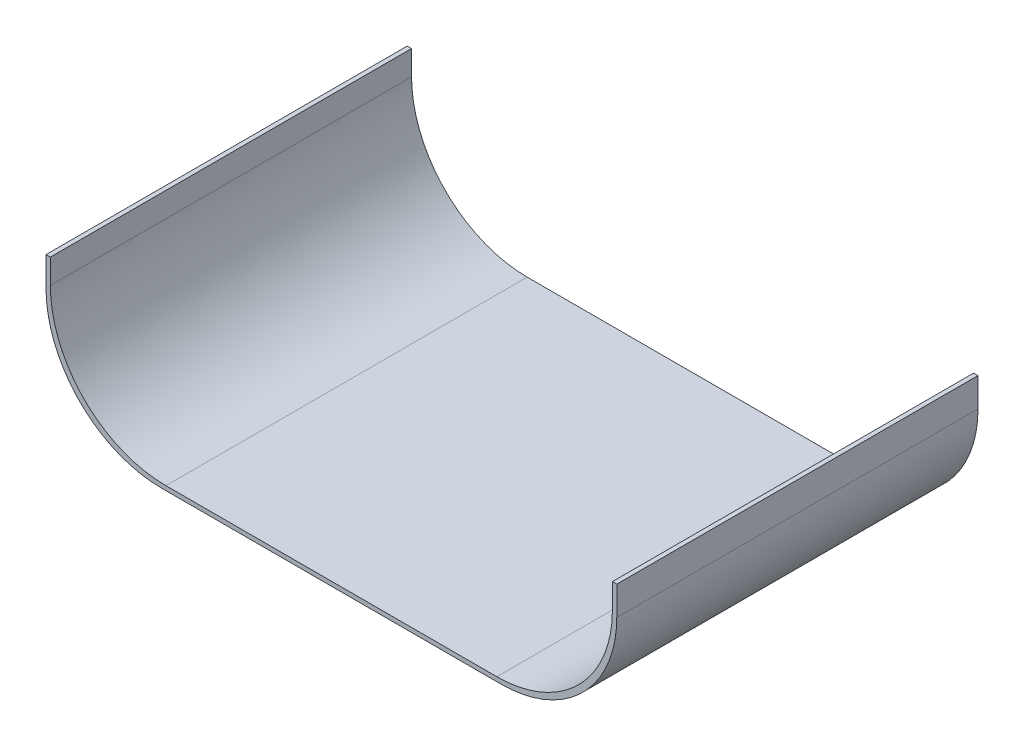
from build123d import *


with BuildPart() as part:
    # Sweep1: sweep along a path in Sketch1
    with BuildLine(Plane(origin=(0, 0, 0), x_dir=(1, 0, 0), z_dir=(0, 1, 0))) as sweep1_path:
        Line((197.5, 0), (197.5, 250))
    # Sketch4 → Sweep1 (sweep)
    with BuildSketch(Plane.XY):
        with BuildLine():
            Line((0, 0), (0, -20))
            ThreePointArc((0, -20), (23.431457505, -76.568542495), (80, -100))
            Line((80, -100), (315, -100))
            ThreePointArc((315, -100), (371.568542495, -76.568542495), (395, -20))
            Line((395, -20), (395, 0))
            Line((395, 0), (392, 0))
            Line((392, 0), (392, -17))
            ThreePointArc((392, -17), (368.568542495, -73.568542495), (312, -97))
            Line((312, -97), (83, -97))
            ThreePointArc((83, -97), (26.431457505, -73.568542495), (3, -17))
            Line((3, -17), (3, 0))
            Line((3, 0), (0, 0))
        make_face()
    sweep(path=sweep1_path.line)


solid = part.part
